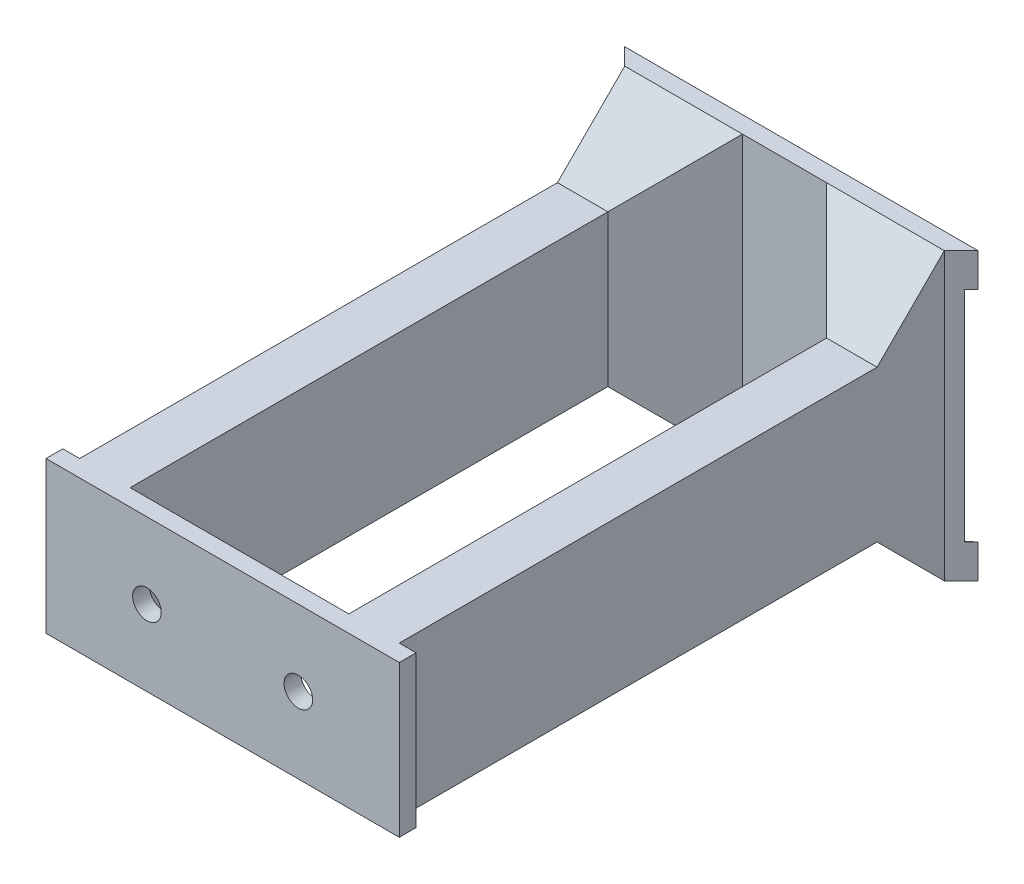
from build123d import *

# Parameters (mm, degrees)
SKETCH1_W           = 65
SKETCH1_H           = 162
BOSS_EXTRUDE1_DEPTH = 42.5
CUT_EXTRUDE1_DEPTH  = 206.949629764
CUT_EXTRUDE2_REACH  = 207.95
SKETCH4_R           = 4.25
SKETCH5_W           = 2
SKETCH5_H           = 65
CUT_EXTRUDE3_DEPTH  = 206.949629919
CHAMFER1_SIZE       = 20


with BuildPart() as part:
    # Sketch1 → Boss-Extrude1 (new, symmetric)
    with BuildSketch(Plane(origin=(0, 0, 0), x_dir=(1, 0, 0), z_dir=(0, 1, 0))):
        Polygon((100, 5), (100, 167), (105, 172), (0, 172), (5, 167), (5, 5), (0, 5), (0, 0), (105, 0), (105, 5), align=None)
        with Locations((52.5, 86)):
            Rectangle(SKETCH1_W, SKETCH1_H, mode=Mode.SUBTRACT)
    extrude(amount=BOSS_EXTRUDE1_DEPTH, both=True)

    # Sketch2 → Cut-Extrude1 (cut, through all)
    with BuildSketch(Plane(origin=(0, 0, 0), x_dir=(0, 0, -1), z_dir=(1, 0, 0))):
        Polygon((0, 22.5), (147, 22.5), (167, 42.5), (0, 42.5), align=None)
    cut_extrude1 = extrude(amount=CUT_EXTRUDE1_DEPTH, mode=Mode.SUBTRACT)

    # Mirror1: Cut-Extrude1 across plane
    add(cut_extrude1.mirror(Plane.ZX), mode=Mode.SUBTRACT)

    # Sketch3 → section 0 of cut_loft1
    with BuildSketch(Plane(origin=(0, 0, -170), x_dir=(-1, 0, 0), z_dir=(0, 0, -1)), mode=Mode.PRIVATE) as cut_loft1_s0:
        with BuildLine():
            Line((-102.5, 40), (0, 40))
            Line((0, 40), (0, -40))
            Line((0, -40), (-102.5, -40))
            Line((-102.5, -40), (-102.5, 40))
        make_face()
    # loft up to a face of the part (cut_loft1)
    loft([cut_loft1_s0.sketch, part.faces().sort_by_distance((52.5, 0, -172))[0]], mode=Mode.SUBTRACT)

    # Sketch4 → Cut-Extrude2 (cut, up to next)
    with BuildSketch(Plane.XY, mode=Mode.PRIVATE) as cut_extrude2_sk1:
        with Locations((30, 0)):
            Circle(SKETCH4_R)
    cut_extrude2_tool1 = extrude(cut_extrude2_sk1.sketch, amount=-CUT_EXTRUDE2_REACH, mode=Mode.PRIVATE) & part.part
    # Sketch4 → Cut-Extrude2 (cut, up to next)
    with BuildSketch(Plane.XY, mode=Mode.PRIVATE) as cut_extrude2_sk2:
        with Locations((75, 0)):
            Circle(SKETCH4_R)
    cut_extrude2_tool2 = extrude(cut_extrude2_sk2.sketch, amount=-CUT_EXTRUDE2_REACH, mode=Mode.PRIVATE) & part.part
    add(cut_extrude2_tool1.solids().sort_by_distance((30, 0, 0))[0], mode=Mode.SUBTRACT)
    add(cut_extrude2_tool2.solids().sort_by_distance((75, 0, 0))[0], mode=Mode.SUBTRACT)

    # Sketch5 → Cut-Extrude3 (cut, through all)
    with BuildSketch(Plane(origin=(0, 0, 0), x_dir=(0, 0, -1), z_dir=(1, 0, 0))):
        with Locations((171, 0)):
            Rectangle(SKETCH5_W, SKETCH5_H)
    extrude(amount=CUT_EXTRUDE3_DEPTH, mode=Mode.SUBTRACT)

    # Chamfer1
    chamfer1_edges = [part.edges().sort_by_distance(p)[0] for p in [
        (85, 0, -167),
        (20, 0, -167),
    ]]
    chamfer(chamfer1_edges, length=CHAMFER1_SIZE)


solid = part.part
